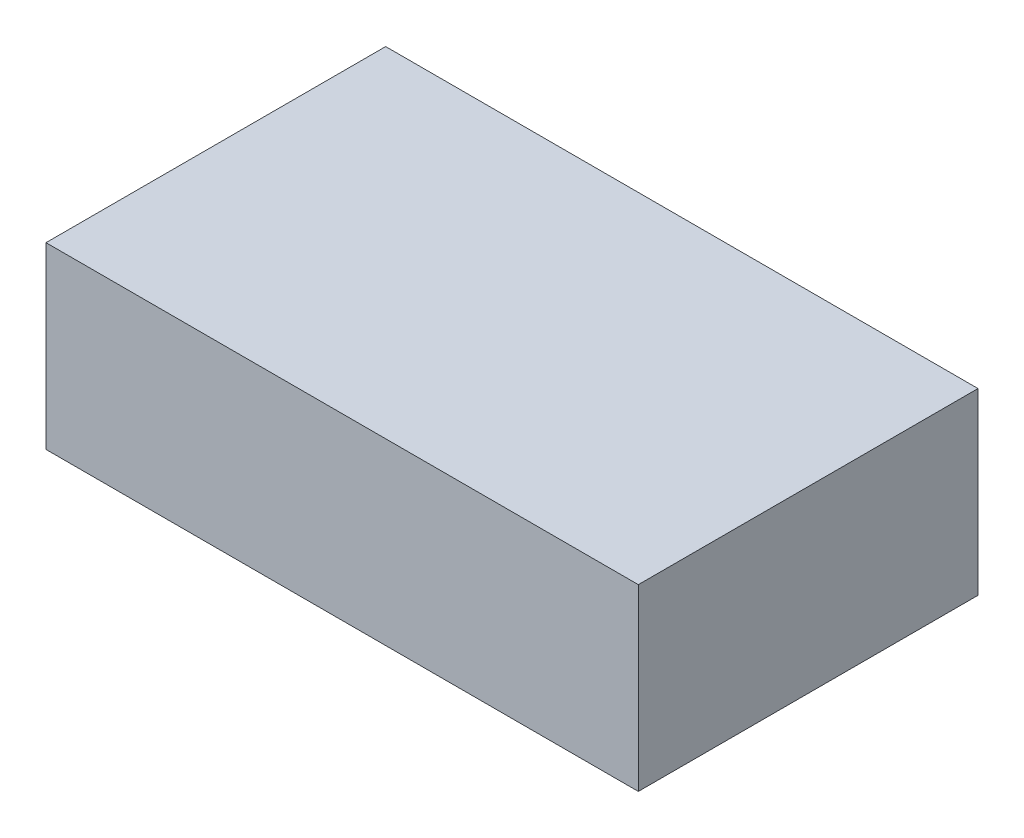
from build123d import *

# Parameters (mm, degrees)
SKETCH1_W           = 46.7
SKETCH1_H           = 26.78
BOSS_EXTRUDE1_DEPTH = 14.12


with BuildPart() as part:
    # Sketch1 → Boss-Extrude1 (new body)
    with BuildSketch(Plane(origin=(0, 0, 0), x_dir=(1, 0, 0), z_dir=(0, 1, 0))):
        Rectangle(SKETCH1_W, SKETCH1_H)
    extrude(amount=BOSS_EXTRUDE1_DEPTH)


solid = part.part
